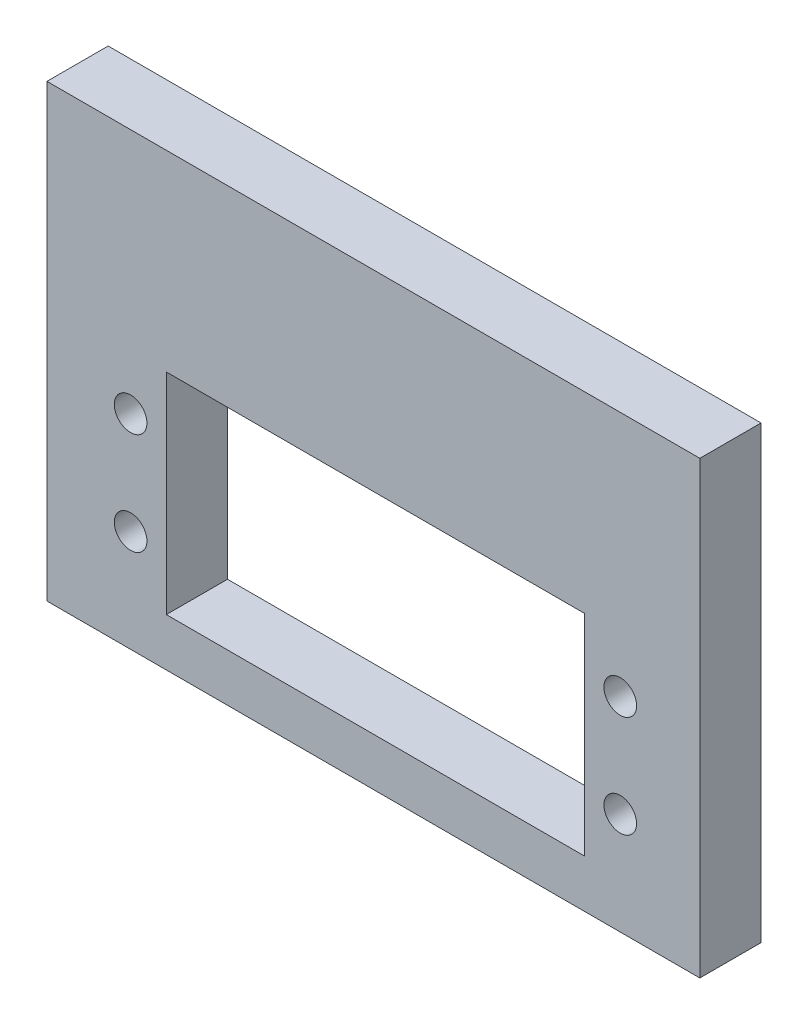
from build123d import *

# Parameters (mm, degrees)
SKETCH1_W           = 64
SKETCH1_H           = 44.12027238
SKETCH1_R           = 1.6
SKETCH1_W_2         = 41
SKETCH1_H_2         = 20.6
BOSS_EXTRUDE1_DEPTH = 6


with BuildPart() as part:
    # Sketch1 → Boss-Extrude1 (new body)
    with BuildSketch(Plane.XY):
        with Locations((10, 26.93986381)):
            Rectangle(SKETCH1_W, SKETCH1_H)
        with Locations((-13.8, 14.87972762)):
            Circle(SKETCH1_R, mode=Mode.SUBTRACT)
        with Locations((-13.8, 24.87972762)):
            Circle(SKETCH1_R, mode=Mode.SUBTRACT)
        with Locations((34.2, 14.87972762)):
            Circle(SKETCH1_R, mode=Mode.SUBTRACT)
        with Locations((34.2, 24.87972762)):
            Circle(SKETCH1_R, mode=Mode.SUBTRACT)
        with Locations((10.2, 19.87972762)):
            Rectangle(SKETCH1_W_2, SKETCH1_H_2, mode=Mode.SUBTRACT)
    extrude(amount=BOSS_EXTRUDE1_DEPTH)


solid = part.part
